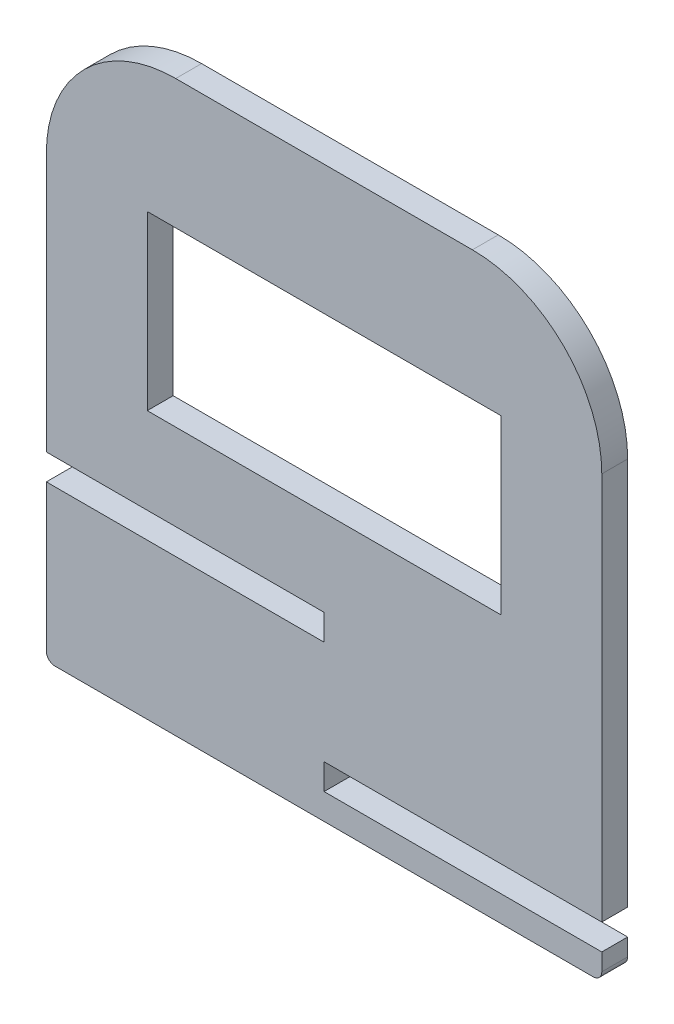
from build123d import *

# Parameters (mm, degrees)
SKETCH1_W           = 41
SKETCH1_H           = 20
BOSS_EXTRUDE7_DEPTH = 3


with BuildPart() as part:
    # Sketch1 → Boss-Extrude7 (new body)
    with BuildSketch(Plane.XY):
        with BuildLine():
            Line((-49.661503554, -6.420867766), (-15.261503554, -6.420867766))
            ThreePointArc((-15.261503554, -6.420867766), (-4.654901836, -10.814266048), (-0.261503554, -21.420867766))
            Line((-0.261503554, -21.420867766), (-0.261503554, -66.420867766))
            Line((-0.261503554, -66.420867766), (-32.461503554, -66.420867766))
            Line((-32.461503554, -66.420867766), (-32.461503554, -69.420867766))
            Line((-32.461503554, -69.420867766), (-0.261503554, -69.420867766))
            Line((-0.261503554, -69.420867766), (-0.261503554, -71.420867766))
            ThreePointArc((-0.261503554, -71.420867766), (-0.554396773, -72.127974547), (-1.261503554, -72.420867766))
            Line((-1.261503554, -72.420867766), (-63.661503554, -72.420867766))
            ThreePointArc((-63.661503554, -72.420867766), (-64.368610335, -72.127974547), (-64.661503554, -71.420867766))
            Line((-64.661503554, -71.420867766), (-64.661503554, -54.420867766))
            Line((-64.661503554, -54.420867766), (-32.461503554, -54.420867766))
            Line((-32.461503554, -54.420867766), (-32.461503554, -51.420867766))
            Line((-32.461503554, -51.420867766), (-64.661503554, -51.420867766))
            Line((-64.661503554, -51.420867766), (-64.661503554, -21.420867766))
            ThreePointArc((-64.661503554, -21.420867766), (-60.268105272, -10.814266048), (-49.661503554, -6.420867766))
        make_face()
        with Locations((-32.461503554, -31.420867766)):
            Rectangle(SKETCH1_W, SKETCH1_H, mode=Mode.SUBTRACT)
    extrude(amount=BOSS_EXTRUDE7_DEPTH)


solid = part.part
